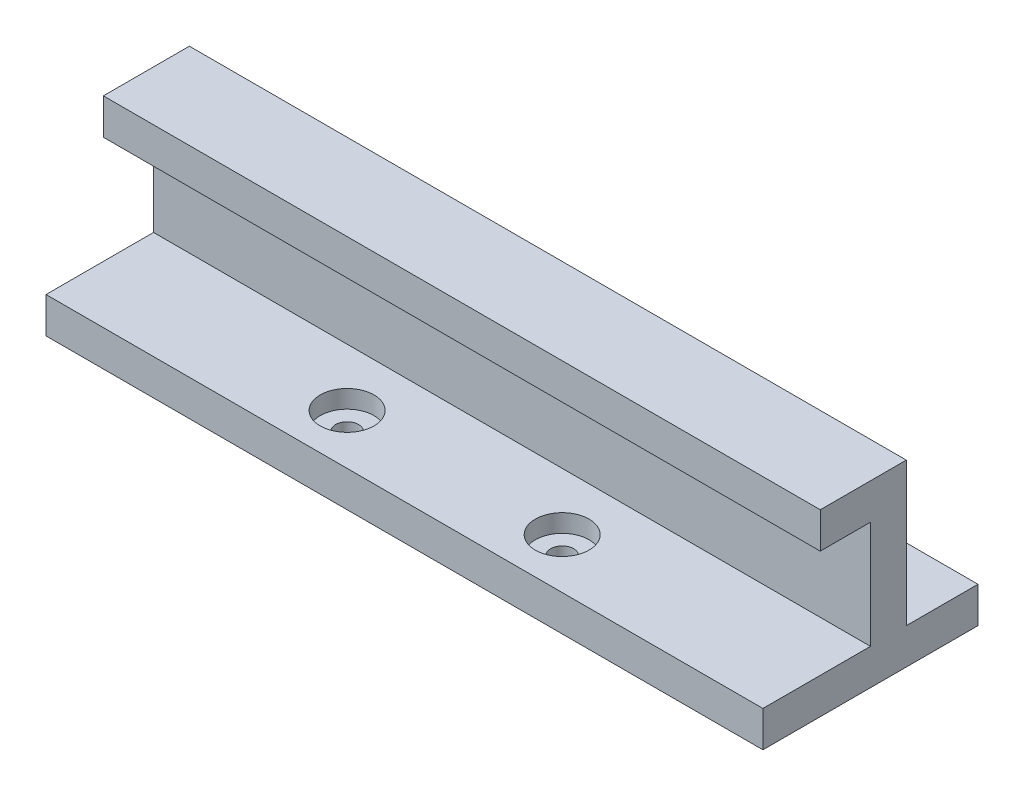
from build123d import *

# Parameters (mm, degrees)
SKETCH1_W                    = 100
SKETCH1_H                    = 20
SKETCH1_R                    = 1.6
EXTRUDE_BASE_DEPTH           = 5
SKETCH2_W                    = 100
SKETCH2_H                    = 5
EXTRUDE_VERTICAL_CLAMP_DEPTH = 20
SKETCH3_W                    = 100
SKETCH3_H                    = 5
EXTRUDE_CLAMP_ROOF_DEPTH     = 7
SKETCH5_W                    = 100
SKETCH5_H                    = 10
SKETCH5_R                    = 1.6
BOSS_EXTRUDE4_DEPTH          = 5
SKETCH4_R                    = 3.75
CUT_EXTRUDE1_DEPTH           = 2.5


with BuildPart() as part:
    # Sketch1 → Extrude-Base (new body)
    with BuildSketch(Plane(origin=(0, 0, 0), x_dir=(1, 0, 0), z_dir=(0, 1, 0))):
        with Locations((50, 10)):
            Rectangle(SKETCH1_W, SKETCH1_H)
        with Locations(Location((35, 7, 0), (0, 0, 270))):
            Circle(SKETCH1_R, mode=Mode.SUBTRACT)
        with Locations(Location((65, 7, 0), (0, 0, 270))):
            Circle(SKETCH1_R, mode=Mode.SUBTRACT)
    extrude(amount=EXTRUDE_BASE_DEPTH)

    # Sketch2 → Extrude-Vertical clamp (add)
    with BuildSketch(Plane(origin=(0, 5, 0), x_dir=(1, 0, 0), z_dir=(0, 1, 0))):
        with Locations((50, 17.5)):
            Rectangle(SKETCH2_W, SKETCH2_H)
    extrude(amount=EXTRUDE_VERTICAL_CLAMP_DEPTH)

    # Sketch3 → Extrude-Clamp Roof (add)
    with BuildSketch(Plane.XY.offset(-15)):
        with Locations((50, 22.5)):
            Rectangle(SKETCH3_W, SKETCH3_H)
    extrude(amount=EXTRUDE_CLAMP_ROOF_DEPTH)

    # Sketch5 → Boss-Extrude4 (add)
    with BuildSketch(Plane(origin=(0, 0, 0), x_dir=(1, 0, 0), z_dir=(0, 1, 0))):
        with Locations((50, 25)):
            Rectangle(SKETCH5_W, SKETCH5_H)
        with Locations(Location((70, 25, 0), (0, 0, 270))):
            Circle(SKETCH5_R, mode=Mode.SUBTRACT)
        with Locations(Location((30, 25, 0), (0, 0, 270))):
            Circle(SKETCH5_R, mode=Mode.SUBTRACT)
    extrude(amount=BOSS_EXTRUDE4_DEPTH)

    # Sketch4 → Cut-Extrude1 (cut)
    with BuildSketch(Plane(origin=(0, 5, 0), x_dir=(1, 0, 0), z_dir=(0, 1, 0))):
        with Locations(Location((35, 7, 0), (0, 0, 270))):
            Circle(SKETCH4_R)
        with Locations(Location((65, 7, 0), (0, 0, 270))):
            Circle(SKETCH4_R)
        with Locations(Location((30, 25, 0), (0, 0, 270))):
            Circle(SKETCH4_R)
        with Locations(Location((70, 25, 0), (0, 0, 270))):
            Circle(SKETCH4_R)
    extrude(amount=-CUT_EXTRUDE1_DEPTH, mode=Mode.SUBTRACT)


solid = part.part
